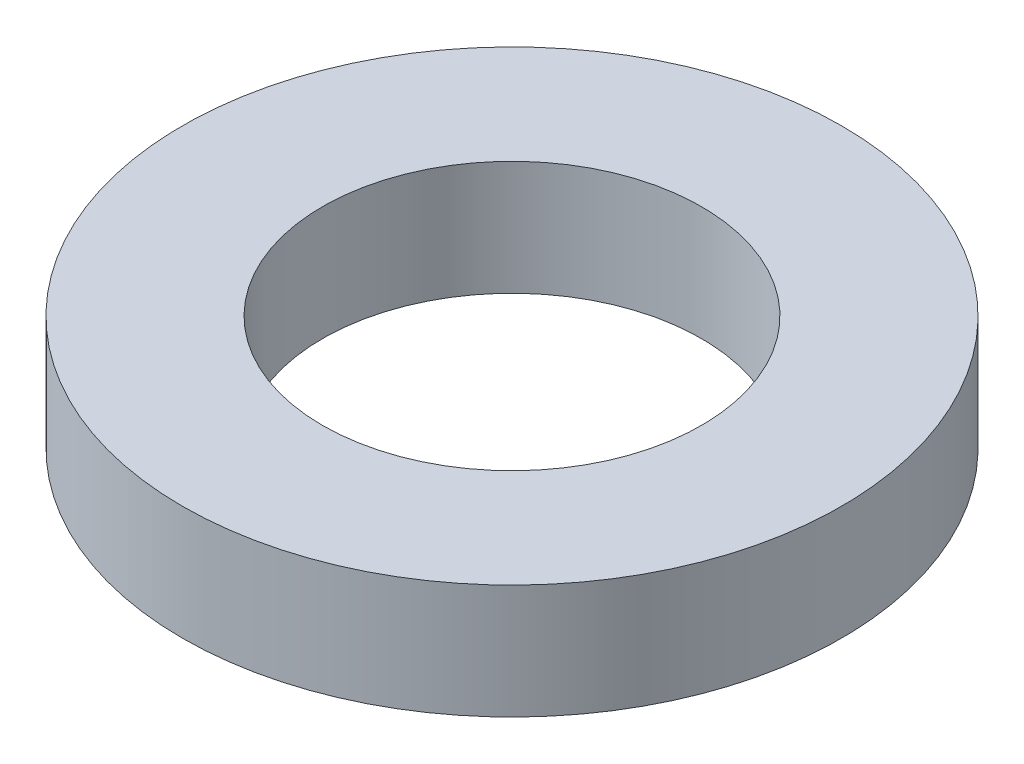
from build123d import *

# Parameters (mm, degrees)
SKETCH1_R           = 28.832991777
SKETCH1_R_2         = 16.579505118
BOSS_EXTRUDE1_DEPTH = 10


with BuildPart() as part:
    # Sketch1 → Boss-Extrude1 (new body)
    with BuildSketch(Plane(origin=(0, 0, 0), x_dir=(1, 0, 0), z_dir=(0, 1, 0))):
        with Locations(Location((0, 0, 0), (0, 0, 270))):
            Circle(SKETCH1_R)
        with Locations(Location((0, 0, 0), (0, 0, 270))):
            Circle(SKETCH1_R_2, mode=Mode.SUBTRACT)
    extrude(amount=BOSS_EXTRUDE1_DEPTH)


solid = part.part
